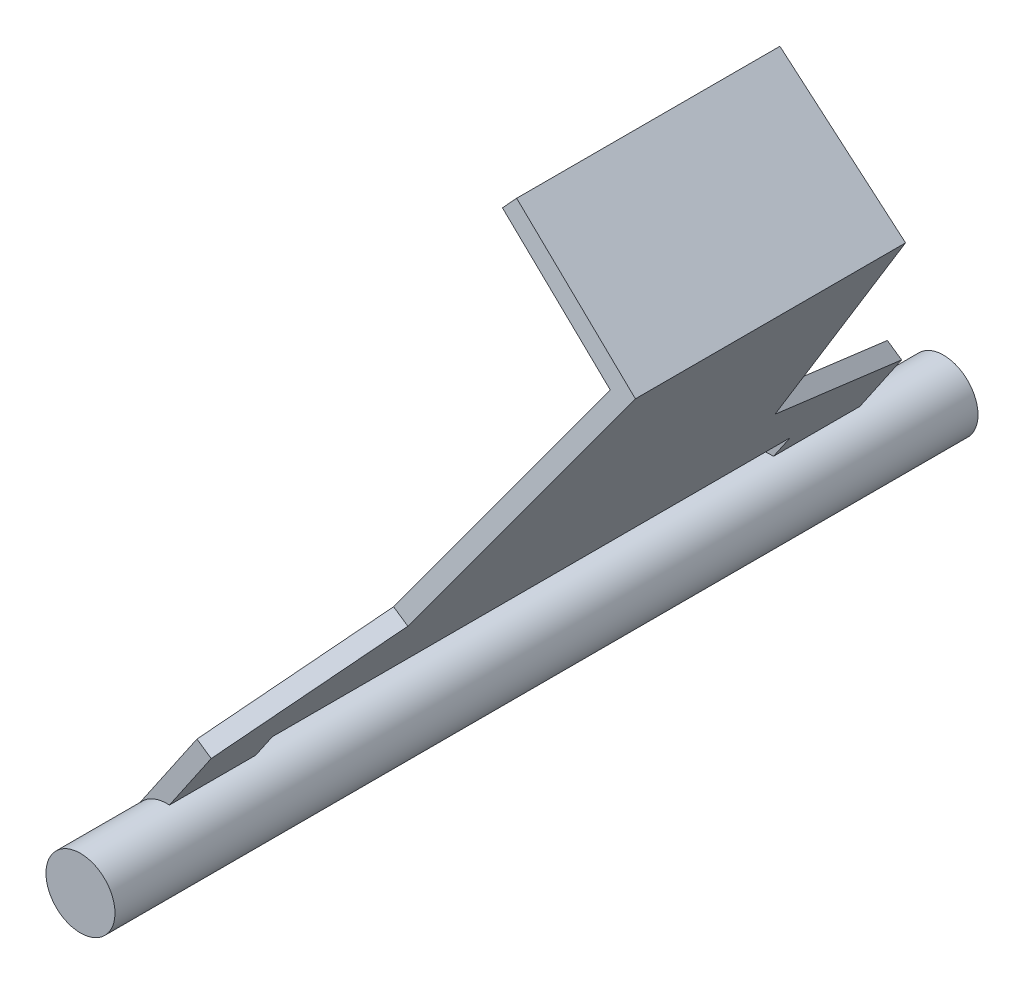
from build123d import *

# Parameters (mm, degrees)
EXTRUDE_1_DEPTH     = 50
EXTRUDE_2_DEPTH     = 40
CUT_EXTRUDE_1_DEPTH = 80
SKETCH_3_R          = 4
CUT_EXTRUDE_2_DEPTH = 30


with BuildPart() as part:
    # 草图1 → 凸台-拉伸1 (new, symmetric)
    with BuildSketch(Plane.XY):
        with BuildLine():
            ThreePointArc((0.301922708, 3.988589059), (-1.732821794, 3.605180804), (-3.303258096, 2.255767265))
            ThreePointArc((-3.303258096, 2.255767265), (-1.180459151, -3.821847222), (4, 0))
            ThreePointArc((4, 0), (2.933231224, 2.719587208), (0.301922708, 3.988589059))
        make_face()
    extrude(amount=EXTRUDE_1_DEPTH, both=True)

    # 草图1<4> → 凸台-拉伸2 (add, symmetric)
    with BuildSketch(Plane.XY):
        with BuildLine():
            Line((27.319803128, 47.098990456), (-3.303258096, 2.255767265))
            ThreePointArc((-3.303258096, 2.255767265), (-1.732821794, 3.605180804), (0.301922708, 3.988589059))
            Line((0.301922708, 3.988589059), (29.953847682, 47.409717989))
            Line((29.953847682, 47.409717989), (15.79365507, 60.256353552))
            Line((15.79365507, 60.256353552), (14.449814561, 58.775106547))
            Line((14.449814561, 58.775106547), (27.319803128, 47.098990456))
        make_face()
    extrude(amount=EXTRUDE_2_DEPTH, both=True)

    # 草图2 → 切除-拉伸1 (cut)
    with BuildSketch(Plane(origin=(-1.651629048, 1.127883632, 0), x_dir=(0, 0, -1), z_dir=(0.8258145239807653, -0.5639418161321451, 0))):
        Polygon((-14.67389456, 62.450241939), (-21.268903351, 19.252934359), (-48.138516321, 8.933823635), (-50.056145045, 74.369577891), (58.321040943, 74.369577891), (48.138516321, 8.933823635), (21.268903351, 19.252934359), (14.67389456, 62.450241939), align=None)
    extrude(amount=-CUT_EXTRUDE_1_DEPTH, mode=Mode.SUBTRACT)

    # 草图3 → 切除-拉伸2 (cut, symmetric)
    with BuildSketch(Plane.XY):
        with BuildLine():
            ThreePointArc((-6.241544, 3.535564886), (2.590014492, -6.68946302), (2.233315761, 6.816846139))
            Line((2.233315761, 6.816846139), (-2.018151301, 9.720137357))
            Line((-2.018151301, 9.720137357), (-5.564648219, 4.526784816))
            Line((-5.564648219, 4.526784816), (-6.241544, 3.535564886))
        make_face()
        Circle(SKETCH_3_R, mode=Mode.SUBTRACT)
    extrude(amount=CUT_EXTRUDE_2_DEPTH, both=True, mode=Mode.SUBTRACT)


solid = part.part
